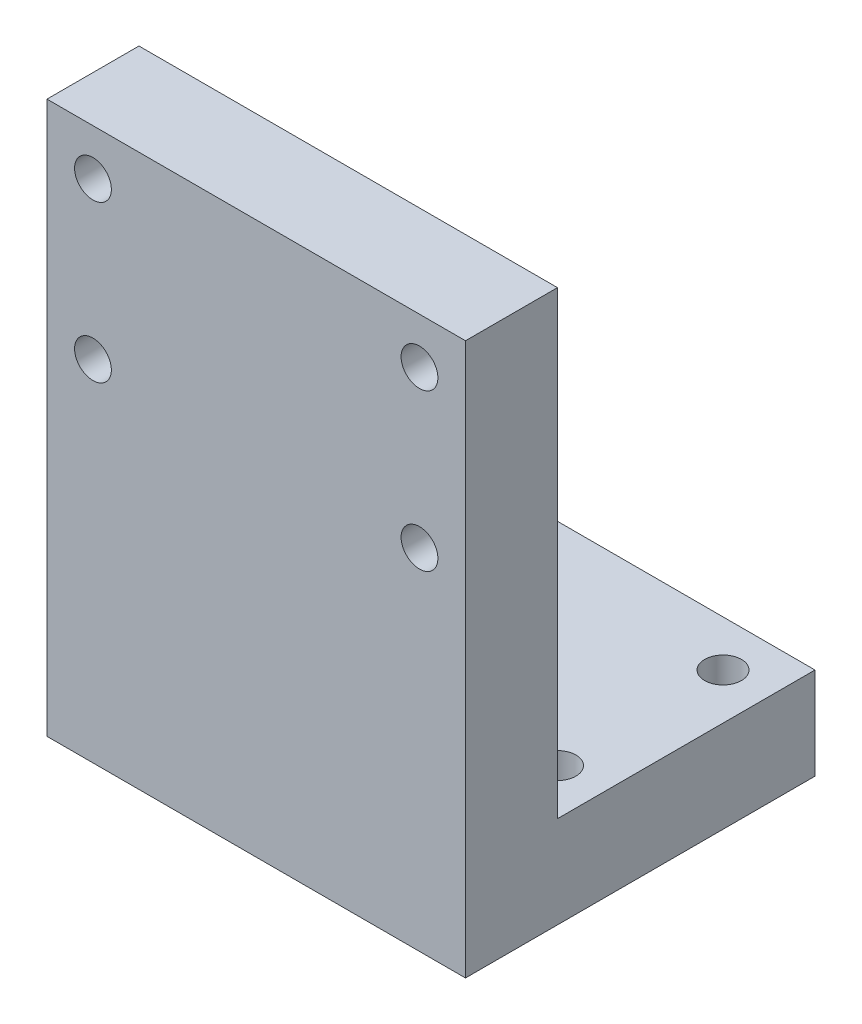
from build123d import *

# Parameters (mm, degrees)
SKETCH1_R              = 2
BASE_EXTRUSION_DEPTH   = 10
SKETCH2_R              = 3
FIRST_BASE_HOLES_DEPTH = 6
SKETCH5_W              = 45.5
SKETCH5_H              = 10
BOSS_EXTRUDE3_DEPTH    = 60
CUT_EXTRUDE2_REACH     = 72.011
SKETCH6_R              = 2
SKETCH7_R              = 3
CUT_EXTRUDE3_DEPTH     = 6


with BuildPart() as part:
    # Sketch1 → Base Extrusion (new body)
    with BuildSketch(Plane(origin=(0, 0, 0), x_dir=(1, 0, 0), z_dir=(0, 1, 0))):
        Polygon((-22.75, 14), (0, 14), (22.75, 14), (22.75, -14), (-22.75, -14), align=None)
        with Locations(Location((-17.75, 9, 0), (0, 0, 270))):
            Circle(SKETCH1_R, mode=Mode.SUBTRACT)
        with Locations(Location((-17.75, -9, 0), (0, 0, 270))):
            Circle(SKETCH1_R, mode=Mode.SUBTRACT)
        with Locations(Location((17.75, 9, 0), (0, 0, 270))):
            Circle(SKETCH1_R, mode=Mode.SUBTRACT)
        with Locations(Location((17.75, -9, 0), (0, 0, 270))):
            Circle(SKETCH1_R, mode=Mode.SUBTRACT)
    extrude(amount=BASE_EXTRUSION_DEPTH)

    # Sketch2 → First Base Holes (cut)
    with BuildSketch(Plane.XZ):
        with Locations(Location((-17.75, 9, 0), (0, 0, 270))):
            Circle(SKETCH2_R)
        with Locations(Location((-17.75, -9, 0), (0, 0, 270))):
            Circle(SKETCH2_R)
        with Locations(Location((17.75, -9, 0), (0, 0, 90))):
            Circle(SKETCH2_R)
        with Locations(Location((17.75, 9, 0), (0, 0, 90))):
            Circle(SKETCH2_R)
    extrude(amount=-FIRST_BASE_HOLES_DEPTH, mode=Mode.SUBTRACT)

    # Sketch5 → Boss-Extrude3 (add)
    with BuildSketch(Plane(origin=(0, 0, 0), x_dir=(1, 0, 0), z_dir=(0, 1, 0))):
        with Locations((0, -19)):
            Rectangle(SKETCH5_W, SKETCH5_H)
    extrude(amount=BOSS_EXTRUDE3_DEPTH)

    # Sketch6 → Cut-Extrude2 (cut, up to next)
    with BuildSketch(Plane(origin=(0, 0, 14), x_dir=(-1, 0, 0), z_dir=(0, 0, -1)), mode=Mode.PRIVATE) as cut_extrude2_sk1:
        with Locations((-17.75, 55)):
            Circle(SKETCH6_R)
    cut_extrude2_tool1 = extrude(cut_extrude2_sk1.sketch, amount=-CUT_EXTRUDE2_REACH, mode=Mode.PRIVATE) & part.part
    # Sketch6 → Cut-Extrude2 (cut, up to next)
    with BuildSketch(Plane(origin=(0, 0, 14), x_dir=(-1, 0, 0), z_dir=(0, 0, -1)), mode=Mode.PRIVATE) as cut_extrude2_sk2:
        with Locations((-17.75, 38)):
            Circle(SKETCH6_R)
    cut_extrude2_tool2 = extrude(cut_extrude2_sk2.sketch, amount=-CUT_EXTRUDE2_REACH, mode=Mode.PRIVATE) & part.part
    # Sketch6 → Cut-Extrude2 (cut, up to next)
    with BuildSketch(Plane(origin=(0, 0, 14), x_dir=(-1, 0, 0), z_dir=(0, 0, -1)), mode=Mode.PRIVATE) as cut_extrude2_sk3:
        with Locations((17.75, 55)):
            Circle(SKETCH6_R)
    cut_extrude2_tool3 = extrude(cut_extrude2_sk3.sketch, amount=-CUT_EXTRUDE2_REACH, mode=Mode.PRIVATE) & part.part
    # Sketch6 → Cut-Extrude2 (cut, up to next)
    with BuildSketch(Plane(origin=(0, 0, 14), x_dir=(-1, 0, 0), z_dir=(0, 0, -1)), mode=Mode.PRIVATE) as cut_extrude2_sk4:
        with Locations((17.75, 38)):
            Circle(SKETCH6_R)
    cut_extrude2_tool4 = extrude(cut_extrude2_sk4.sketch, amount=-CUT_EXTRUDE2_REACH, mode=Mode.PRIVATE) & part.part
    add(cut_extrude2_tool1.solids().sort_by_distance((17.75, 55, 14))[0], mode=Mode.SUBTRACT)
    add(cut_extrude2_tool2.solids().sort_by_distance((17.75, 38, 14))[0], mode=Mode.SUBTRACT)
    add(cut_extrude2_tool3.solids().sort_by_distance((-17.75, 55, 14))[0], mode=Mode.SUBTRACT)
    add(cut_extrude2_tool4.solids().sort_by_distance((-17.75, 38, 14))[0], mode=Mode.SUBTRACT)

    # Sketch7 → Cut-Extrude3 (cut)
    with BuildSketch(Plane(origin=(0, 0, 14), x_dir=(-1, 0, 0), z_dir=(0, 0, -1))):
        with Locations((-17.75, 55)):
            Circle(SKETCH7_R)
        with Locations((-17.75, 38)):
            Circle(SKETCH7_R)
        with Locations(Location((17.75, 38, 0), (0, 0, 180))):
            Circle(SKETCH7_R)
        with Locations(Location((17.75, 55, 0), (0, 0, 180))):
            Circle(SKETCH7_R)
    extrude(amount=-CUT_EXTRUDE3_DEPTH, mode=Mode.SUBTRACT)


solid = part.part
